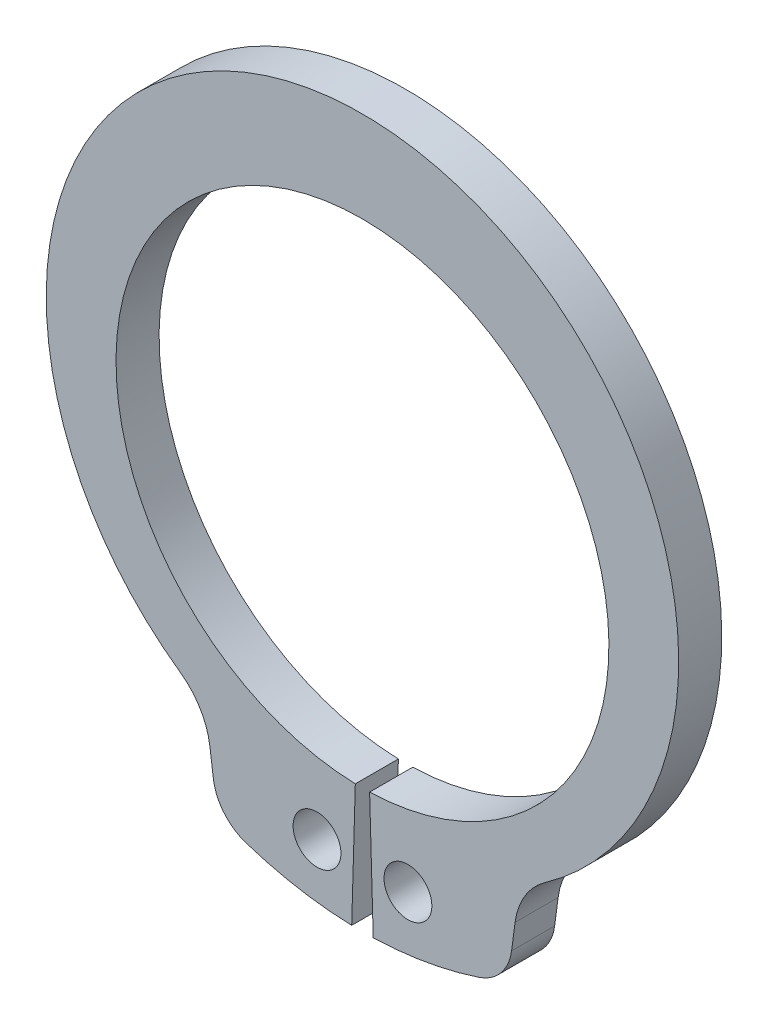
from build123d import *

# Parameters (mm, degrees)
BODYSKE_R  = 0.5
BODY_DEPTH = 0.9


with BuildPart() as part:
    # BodySke → Body (new body)
    with BuildSketch(Plane.XY):
        with BuildLine():
            Line((0.149516129, -5.147829147), (0.225, -7.746733182))
            ThreePointArc((0.225, -7.746733182), (1.346405797, -7.632148546), (2.43932707, -7.356098385))
            ThreePointArc((2.43932707, -7.356098385), (2.895343336, -7.044040139), (3.116020052, -6.537450592))
            Line((3.116020052, -6.537450592), (3.188669173, -5.985625726))
            ThreePointArc((3.188669173, -5.985625726), (3.391875738, -5.406047825), (3.810453497, -4.95660805))
            ThreePointArc((3.810453497, -4.95660805), (0, 7.05), (-3.810453497, -4.95660805))
            ThreePointArc((-3.810453497, -4.95660805), (-3.391875738, -5.406047825), (-3.188669173, -5.985625726))
            Line((-3.188669173, -5.985625726), (-3.116020052, -6.537450592))
            ThreePointArc((-3.116020052, -6.537450592), (-2.895343336, -7.044040139), (-2.43932707, -7.356098385))
            ThreePointArc((-2.43932707, -7.356098385), (-1.346405797, -7.632148546), (-0.225, -7.746733182))
            Line((-0.225, -7.746733182), (-0.149516129, -5.147829147))
            ThreePointArc((-0.149516129, -5.147829147), (0, 5.15), (0.149516129, -5.147829147))
        make_face()
        with Locations((0.95, -6.556533002)):
            Circle(BODYSKE_R, mode=Mode.SUBTRACT)
        with Locations((-0.95, -6.556533002)):
            Circle(BODYSKE_R, mode=Mode.SUBTRACT)
    extrude(amount=-BODY_DEPTH)


solid = part.part
